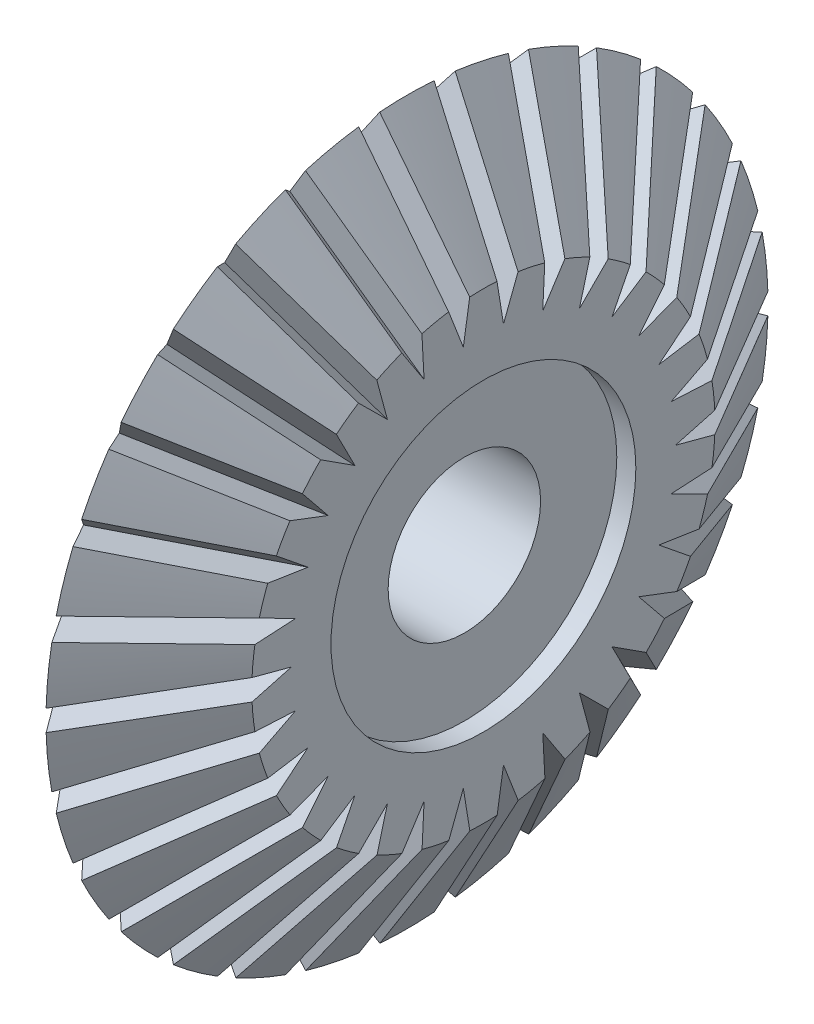
from build123d import *

# Parameters (mm, degrees)
MATRIZC2_COUNT          = 30
CROQUIS4_R              = 40
CORTAR_EXTRUIR1_DEPTH   = 5
CROQUIS5_R              = 30.164396759
SALIENTE_EXTRUIR1_DEPTH = 5
CROQUIS6_R              = 20
CORTAR_EXTRUIR2_DEPTH   = 135


with BuildPart() as part:
    # Croquis1 → Revolución1 (revolve)
    with BuildSketch(Plane(origin=(0, 0, 0), x_dir=(1, 0, 0), z_dir=(0, 1, 0)), mode=Mode.PRIVATE) as revoluci_n1_sk:
        Polygon((0, 0), (0, 60.770322879), (-20.052160411, 94.736227249), (-40.104320822, 60.770322879), (-40.104320822, 0), align=None)
    revolve(revoluci_n1_sk.sketch.rotate(Axis((0, 0, 0), (1, 0, 0)), 180), axis=Axis((0, 0, 0), (1, 0, 0)))

    # Cortar-Barrer1: sweep along a path in Croquis3
    with BuildLine(Plane(origin=(26.604187637, 0, -15.706086677), x_dir=(-0.5083797263647387, 0, -0.8611330058831291), z_dir=(0.8611330058831291, 0, -0.5083797263647387))) as cortar_barrer1_path:
        Line((91.77460396, 0), (0, 0))
    # Croquis2 → Cortar-Barrer1 (sweep, cut)
    with BuildSketch(Plane(origin=(-56.343548901, 0, -33.26305899), x_dir=(-0.5083797263647387, 0, 0.8611330058831291), z_dir=(-0.8611330058831291, 0, -0.5083797263647387))):
        Polygon((-71.351774752, -2.759083331), (-65.358630188, 0), (-71.350720293, 2.800794556), (-75.036841039, 0), align=None)
    cortar_barrer1 = sweep(path=cortar_barrer1_path.line, mode=Mode.SUBTRACT)

    # MatrizC2: Cortar-Barrer1 ×30 about axis
    matrizc2_axis = Axis((0, 0, 0), (1, 0, 0))
    for i in range(1, MATRIZC2_COUNT):
        add(cortar_barrer1.rotate(matrizc2_axis, i * 360 / MATRIZC2_COUNT), mode=Mode.SUBTRACT)

    # Croquis4 → Cortar-Extruir1 (cut)
    with BuildSketch(Plane(origin=(0, 0, 0), x_dir=(0, 0, -1), z_dir=(1, 0, 0))):
        Circle(CROQUIS4_R)
    extrude(amount=-CORTAR_EXTRUIR1_DEPTH, mode=Mode.SUBTRACT)

    # Croquis5 → Saliente-Extruir1 (add)
    with BuildSketch(Plane.ZY.offset(40.104320822)):
        Circle(CROQUIS5_R)
    extrude(amount=SALIENTE_EXTRUIR1_DEPTH)

    # Croquis6 → Cortar-Extruir2 (cut)
    with BuildSketch(Plane.ZY.offset(45.104320822)):
        Circle(CROQUIS6_R)
    extrude(amount=-CORTAR_EXTRUIR2_DEPTH, mode=Mode.SUBTRACT)


solid = part.part
